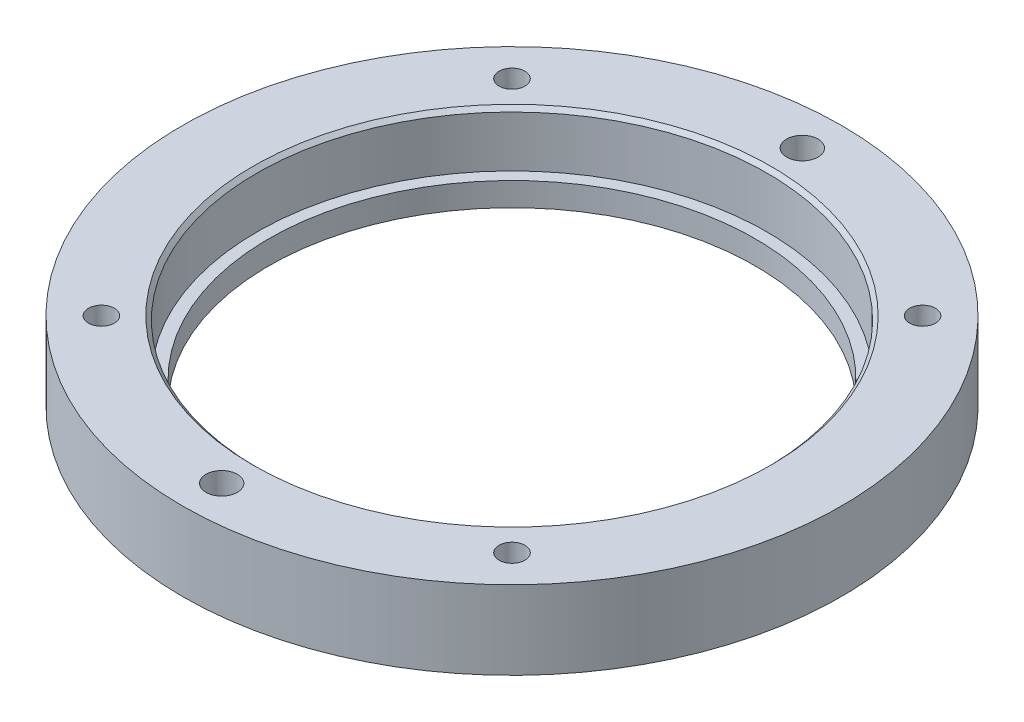
from build123d import *

# Parameters (mm, degrees)
DIAM_TRE_DU_PER_AGE_4_0_4_1_D     = 4
DIAM_TRE_DU_PER_AGE_4_0_4_1_DEPTH = 5
DIAM_TRE_DU_PER_AGE_4_0_4_1_TIP   = 1.201721238
TROU_TARAUD_M41_D                 = 3.3
R_P_TITION_CIRCULAIRE1_COUNT      = 4
CHANFREIN1_SIZE                   = 0.5


with BuildPart() as part:
    # Esquisse1 → Révolution1 (revolve)
    with BuildSketch(Plane(origin=(0, 0, 0), x_dir=(0, 0, -1), z_dir=(1, 0, 0))):
        Polygon((-31, -3), (-31, 0), (-32.5, 0), (-32.5, 7), (-42, 7), (-42, -3), align=None)
    revolve(axis=Axis((0, 0, 0), (0, -1, 0)))

    # Diamètre du perçage Ø4.0 (4)1
    with Locations(Plane(origin=(0, 7, 0), x_dir=(1, 0, 0), z_dir=(0, 1, 0))):
        with Locations((0, 37), (0, -37)):
            Hole(DIAM_TRE_DU_PER_AGE_4_0_4_1_D / 2, depth=DIAM_TRE_DU_PER_AGE_4_0_4_1_DEPTH)
            with Locations((0, 0, -(DIAM_TRE_DU_PER_AGE_4_0_4_1_DEPTH + DIAM_TRE_DU_PER_AGE_4_0_4_1_TIP / 2))):  # 118° drill point
                Cone(0, DIAM_TRE_DU_PER_AGE_4_0_4_1_D / 2, DIAM_TRE_DU_PER_AGE_4_0_4_1_TIP, mode=Mode.SUBTRACT)

    # Trou taraudé M41 (through all)
    with Locations(Plane(origin=(0, 7, 0), x_dir=(1, 0, 0), z_dir=(0, 1, 0))):
        with Locations((-26.162950904, 26.162950904)):
            trou_taraud_m41 = Hole(TROU_TARAUD_M41_D / 2)

    # Répétition circulaire1: Trou taraudé M41 ×4 about axis
    r_p_tition_circulaire1_axis = Axis((0, 0, 0), (0, 1, 0))
    for i in range(1, R_P_TITION_CIRCULAIRE1_COUNT):
        add(trou_taraud_m41.rotate(r_p_tition_circulaire1_axis, i * 360 / R_P_TITION_CIRCULAIRE1_COUNT), mode=Mode.SUBTRACT)

    # Chanfrein1
    chanfrein1_edges = [part.edges().sort_by_distance(p)[0] for p in [
        (0, 7, -32.5),
    ]]
    chamfer(chanfrein1_edges, length=CHANFREIN1_SIZE)


solid = part.part
